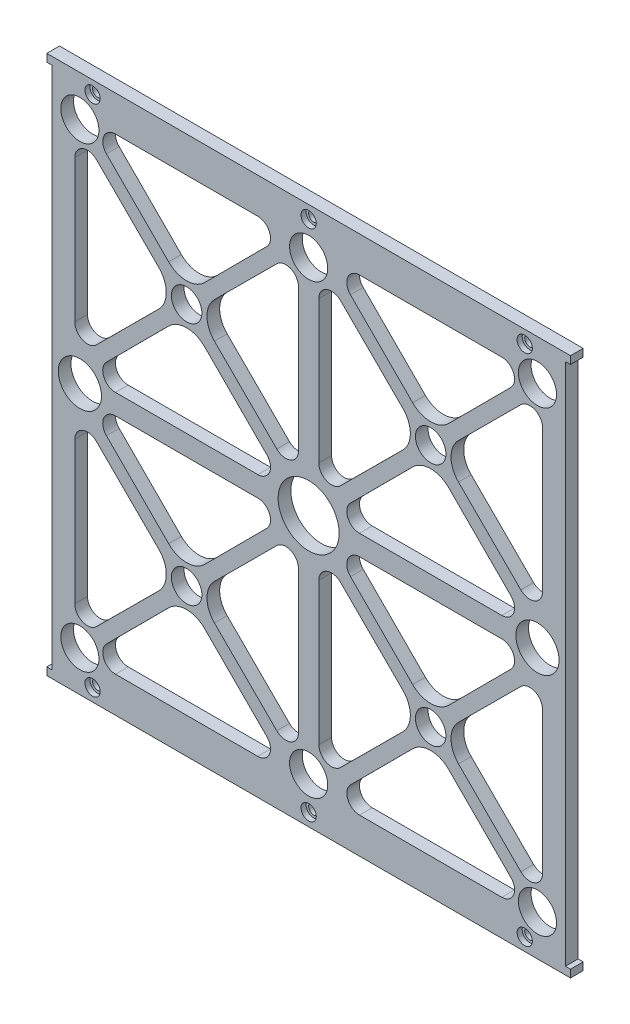
from build123d import *

# Parameters (mm, degrees)
P_IDAT_VYSUNUT_M1_DEPTH  = 5
SKICA2_R                 = 2
ODEBRAT_VYSUNUT_M1_DEPTH = 148.885090526
SKICA4_R                 = 6
ODEBRAT_VYSUNUT_M3_DEPTH = 10
SKICA5_R                 = 3
ODEBRAT_VYSUNUT_M4_DEPTH = 2
SKICA6_R                 = 12
SKICA6_R_2               = 8.5
SKICA6_R_3               = 7.5
ODEBRAT_VYSUNUT_M5_DEPTH = 148.885090526


with BuildPart() as part:
    # Skica1 → Přidat vysunutím1 (new body)
    with BuildSketch(Plane.XY):
        Polygon((-103, 106), (103, 106), (103, 103), (101, 103), (101, -103), (103, -103), (103, -106), (-103, -106), (-103, -103), (-101, -103), (-101, 103), (-103, 103), align=None)
    extrude(amount=P_IDAT_VYSUNUT_M1_DEPTH)

    # Skica2 → Odebrat vysunutím1 (cut, through all)
    with BuildSketch(Plane.XY.offset(5)):
        with Locations((-85, 101)):
            Circle(SKICA2_R)
        with Locations((0, 101)):
            Circle(SKICA2_R)
        with Locations((85, 101)):
            Circle(SKICA2_R)
        with Locations(Location((-85, -101, 0), (0, 0, 180))):
            Circle(SKICA2_R)
        with Locations(Location((0, -101, 0), (0, 0, 180))):
            Circle(SKICA2_R)
        with Locations(Location((85, -101, 0), (0, 0, 180))):
            Circle(SKICA2_R)
    extrude(amount=-ODEBRAT_VYSUNUT_M1_DEPTH, mode=Mode.SUBTRACT)

    # Skica4 → Odebrat vysunutím3 (cut)
    with BuildSketch(Plane.XY.offset(5)):
        with Locations((48, 48)):
            Circle(SKICA4_R)
        with Locations(Location((-48, 48, 0), (0, 0, 180))):
            Circle(SKICA4_R)
        with Locations(Location((48, -48, 0), (0, 0, 180))):
            Circle(SKICA4_R)
        with Locations((-48, -48)):
            Circle(SKICA4_R)
        with BuildLine():
            Line((40.918682945, 58.939196308), (16.459341473, 83.469598154))
            ThreePointArc((16.459341473, 83.469598154), (15.381991272, 88.916766909), (20, 92))
            Line((20, 92), (76, 92))
            ThreePointArc((76, 92), (80.618008728, 88.916766909), (79.540658527, 83.469598154))
            Line((79.540658527, 83.469598154), (55.081317055, 58.939196308))
            ThreePointArc((55.081317055, 58.939196308), (48, 56), (40.918682945, 58.939196308))
        make_face()
        with BuildLine():
            Line((37.060803692, 55.081317055), (12.530401846, 79.540658527))
            ThreePointArc((12.530401846, 79.540658527), (7.083233091, 80.618008728), (4, 76))
            Line((4, 76), (4, 20))
            ThreePointArc((4, 20), (7.083233091, 15.381991272), (12.530401846, 16.459341473))
            Line((12.530401846, 16.459341473), (37.060803692, 40.918682945))
            ThreePointArc((37.060803692, 40.918682945), (40, 48), (37.060803692, 55.081317055))
        make_face()
        with BuildLine():
            Line((58.939196308, 40.918682945), (83.469598154, 16.459341473))
            ThreePointArc((83.469598154, 16.459341473), (88.916766909, 15.381991272), (92, 20))
            Line((92, 20), (92, 76))
            ThreePointArc((92, 76), (88.916766909, 80.618008728), (83.469598154, 79.540658527))
            Line((83.469598154, 79.540658527), (58.939196308, 55.081317055))
            ThreePointArc((58.939196308, 55.081317055), (56, 48), (58.939196308, 40.918682945))
        make_face()
        with BuildLine():
            Line((40.918682945, 37.060803692), (16.459341473, 12.530401846))
            ThreePointArc((16.459341473, 12.530401846), (15.381991272, 7.083233091), (20, 4))
            Line((20, 4), (76, 4))
            ThreePointArc((76, 4), (80.618008728, 7.083233091), (79.540658527, 12.530401846))
            Line((79.540658527, 12.530401846), (55.081317055, 37.060803692))
            ThreePointArc((55.081317055, 37.060803692), (48, 40), (40.918682945, 37.060803692))
        make_face()
        with BuildLine():
            Line((-40.918682945, 58.939196308), (-16.459341473, 83.469598154))
            ThreePointArc((-16.459341473, 83.469598154), (-15.381991272, 88.916766909), (-20, 92))
            Line((-20, 92), (-76, 92))
            ThreePointArc((-76, 92), (-80.618008728, 88.916766909), (-79.540658527, 83.469598154))
            Line((-79.540658527, 83.469598154), (-55.081317055, 58.939196308))
            ThreePointArc((-55.081317055, 58.939196308), (-48, 56), (-40.918682945, 58.939196308))
        make_face()
        with BuildLine():
            Line((-58.939196308, 55.081317055), (-83.469598154, 79.540658527))
            ThreePointArc((-83.469598154, 79.540658527), (-88.916766909, 80.618008728), (-92, 76))
            Line((-92, 76), (-92, 20))
            ThreePointArc((-92, 20), (-88.916766909, 15.381991272), (-83.469598154, 16.459341473))
            Line((-83.469598154, 16.459341473), (-58.939196308, 40.918682945))
            ThreePointArc((-58.939196308, 40.918682945), (-56, 48), (-58.939196308, 55.081317055))
        make_face()
        with BuildLine():
            Line((-55.081317055, 37.060803692), (-79.540658527, 12.530401846))
            ThreePointArc((-79.540658527, 12.530401846), (-80.618008728, 7.083233091), (-76, 4))
            Line((-76, 4), (-20, 4))
            ThreePointArc((-20, 4), (-15.381991272, 7.083233091), (-16.459341473, 12.530401846))
            Line((-16.459341473, 12.530401846), (-40.918682945, 37.060803692))
            ThreePointArc((-40.918682945, 37.060803692), (-48, 40), (-55.081317055, 37.060803692))
        make_face()
        with BuildLine():
            Line((-37.060803692, 40.918682945), (-12.530401846, 16.459341473))
            ThreePointArc((-12.530401846, 16.459341473), (-7.083233091, 15.381991272), (-4, 20))
            Line((-4, 20), (-4, 76))
            ThreePointArc((-4, 76), (-7.083233091, 80.618008728), (-12.530401846, 79.540658527))
            Line((-12.530401846, 79.540658527), (-37.060803692, 55.081317055))
            ThreePointArc((-37.060803692, 55.081317055), (-40, 48), (-37.060803692, 40.918682945))
        make_face()
        with BuildLine():
            Line((40.918682945, -58.939196308), (16.459341473, -83.469598154))
            ThreePointArc((16.459341473, -83.469598154), (15.381991272, -88.916766909), (20, -92))
            Line((20, -92), (76, -92))
            ThreePointArc((76, -92), (80.618008728, -88.916766909), (79.540658527, -83.469598154))
            Line((79.540658527, -83.469598154), (55.081317055, -58.939196308))
            ThreePointArc((55.081317055, -58.939196308), (48, -56), (40.918682945, -58.939196308))
        make_face()
        with BuildLine():
            Line((58.939196308, -55.081317055), (83.469598154, -79.540658527))
            ThreePointArc((83.469598154, -79.540658527), (88.916766909, -80.618008728), (92, -76))
            Line((92, -76), (92, -20))
            ThreePointArc((92, -20), (88.916766909, -15.381991272), (83.469598154, -16.459341473))
            Line((83.469598154, -16.459341473), (58.939196308, -40.918682945))
            ThreePointArc((58.939196308, -40.918682945), (56, -48), (58.939196308, -55.081317055))
        make_face()
        with BuildLine():
            Line((55.081317055, -37.060803692), (79.540658527, -12.530401846))
            ThreePointArc((79.540658527, -12.530401846), (80.618008728, -7.083233091), (76, -4))
            Line((76, -4), (20, -4))
            ThreePointArc((20, -4), (15.381991272, -7.083233091), (16.459341473, -12.530401846))
            Line((16.459341473, -12.530401846), (40.918682945, -37.060803692))
            ThreePointArc((40.918682945, -37.060803692), (48, -40), (55.081317055, -37.060803692))
        make_face()
        with BuildLine():
            Line((37.060803692, -40.918682945), (12.530401846, -16.459341473))
            ThreePointArc((12.530401846, -16.459341473), (7.083233091, -15.381991272), (4, -20))
            Line((4, -20), (4, -76))
            ThreePointArc((4, -76), (7.083233091, -80.618008728), (12.530401846, -79.540658527))
            Line((12.530401846, -79.540658527), (37.060803692, -55.081317055))
            ThreePointArc((37.060803692, -55.081317055), (40, -48), (37.060803692, -40.918682945))
        make_face()
        with BuildLine():
            Line((-37.060803692, -55.081317055), (-12.530401846, -79.540658527))
            ThreePointArc((-12.530401846, -79.540658527), (-7.083233091, -80.618008728), (-4, -76))
            Line((-4, -76), (-4, -20))
            ThreePointArc((-4, -20), (-7.083233091, -15.381991272), (-12.530401846, -16.459341473))
            Line((-12.530401846, -16.459341473), (-37.060803692, -40.918682945))
            ThreePointArc((-37.060803692, -40.918682945), (-40, -48), (-37.060803692, -55.081317055))
        make_face()
        with BuildLine():
            Line((-55.081317055, -58.939196308), (-79.540658527, -83.469598154))
            ThreePointArc((-79.540658527, -83.469598154), (-80.618008728, -88.916766909), (-76, -92))
            Line((-76, -92), (-20, -92))
            ThreePointArc((-20, -92), (-15.381991272, -88.916766909), (-16.459341473, -83.469598154))
            Line((-16.459341473, -83.469598154), (-40.918682945, -58.939196308))
            ThreePointArc((-40.918682945, -58.939196308), (-48, -56), (-55.081317055, -58.939196308))
        make_face()
        with BuildLine():
            Line((-58.939196308, -40.918682945), (-83.469598154, -16.459341473))
            ThreePointArc((-83.469598154, -16.459341473), (-88.916766909, -15.381991272), (-92, -20))
            Line((-92, -20), (-92, -76))
            ThreePointArc((-92, -76), (-88.916766909, -80.618008728), (-83.469598154, -79.540658527))
            Line((-83.469598154, -79.540658527), (-58.939196308, -55.081317055))
            ThreePointArc((-58.939196308, -55.081317055), (-56, -48), (-58.939196308, -40.918682945))
        make_face()
        with BuildLine():
            Line((-40.918682945, -37.060803692), (-16.459341473, -12.530401846))
            ThreePointArc((-16.459341473, -12.530401846), (-15.381991272, -7.083233091), (-20, -4))
            Line((-20, -4), (-76, -4))
            ThreePointArc((-76, -4), (-80.618008728, -7.083233091), (-79.540658527, -12.530401846))
            Line((-79.540658527, -12.530401846), (-55.081317055, -37.060803692))
            ThreePointArc((-55.081317055, -37.060803692), (-48, -40), (-40.918682945, -37.060803692))
        make_face()
    extrude(amount=-ODEBRAT_VYSUNUT_M3_DEPTH, mode=Mode.SUBTRACT)

    # Skica5 → Odebrat vysunutím4 (cut)
    with BuildSketch(Plane.XY.offset(5)):
        with Locations((-85, 101)):
            Circle(SKICA5_R)
        with Locations((0, 101)):
            Circle(SKICA5_R)
        with Locations((85, 101)):
            Circle(SKICA5_R)
        with Locations(Location((-85, -101, 0), (0, 0, 180))):
            Circle(SKICA5_R)
        with Locations(Location((0, -101, 0), (0, 0, 180))):
            Circle(SKICA5_R)
        with Locations(Location((85, -101, 0), (0, 0, 180))):
            Circle(SKICA5_R)
    extrude(amount=-ODEBRAT_VYSUNUT_M4_DEPTH, mode=Mode.SUBTRACT)

    # Skica6 → Odebrat vysunutím5 (cut, through all)
    with BuildSketch(Plane.XY.offset(5)):
        Circle(SKICA6_R)
        with Locations((-90, 0)):
            Circle(SKICA6_R_2)
        with Locations(Location((90, 0, 0), (0, 0, 180))):
            Circle(SKICA6_R_2)
        with Locations((-90, 90)):
            Circle(SKICA6_R_3)
        with Locations((90, 90)):
            Circle(SKICA6_R_3)
        with Locations((90, -90)):
            Circle(SKICA6_R_3)
        with Locations((-90, -90)):
            Circle(SKICA6_R_3)
        with Locations((0, 88)):
            Circle(SKICA6_R_3)
        with Locations(Location((0, -88, 0), (0, 0, 180))):
            Circle(SKICA6_R_3)
    extrude(amount=-ODEBRAT_VYSUNUT_M5_DEPTH, mode=Mode.SUBTRACT)


solid = part.part
